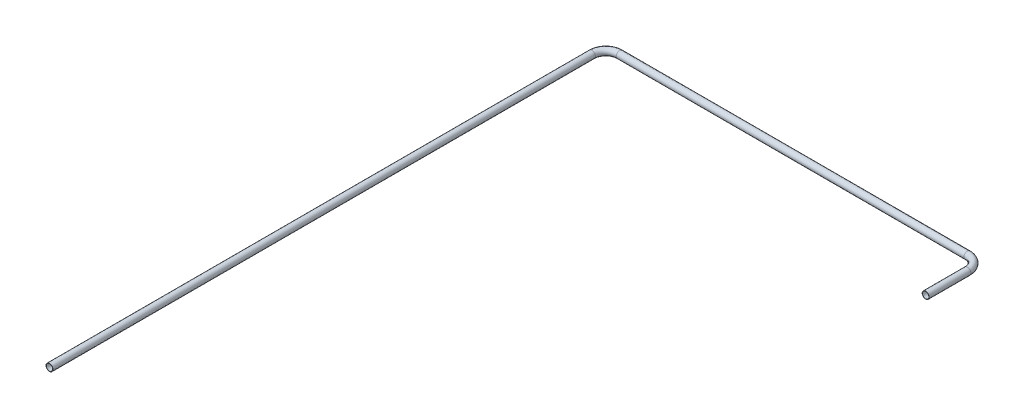
from build123d import *

# Parameters (mm, degrees)
SKETCH14_R   = 38.1
SKETCH14_R_2 = 34.925


with BuildPart() as part:
    # Sweep1: sweep along a path in Sketch13
    with BuildLine(Plane(origin=(0, 0, 0), x_dir=(1, 0, 0), z_dir=(0, 1, 0))) as sweep1_path:
        Line((-4114.8, -6096), (-4114.8, -152.4))
        ThreePointArc((-4114.8, -152.4), (-4070.163073453, -44.636926547), (-3962.4, 0))
        Line((-3962.4, 0), (-152.4, 0))
        ThreePointArc((-152.4, 0), (-44.636926547, -44.636926547), (0, -152.4))
        Line((0, -152.4), (0, -609.6))
    # Sketch14 → Sweep1 (sweep)
    with BuildSketch(Plane.XY.offset(609.6)):
        Circle(SKETCH14_R)
        Circle(SKETCH14_R_2, mode=Mode.SUBTRACT)
    sweep(path=sweep1_path.line)


solid = part.part
